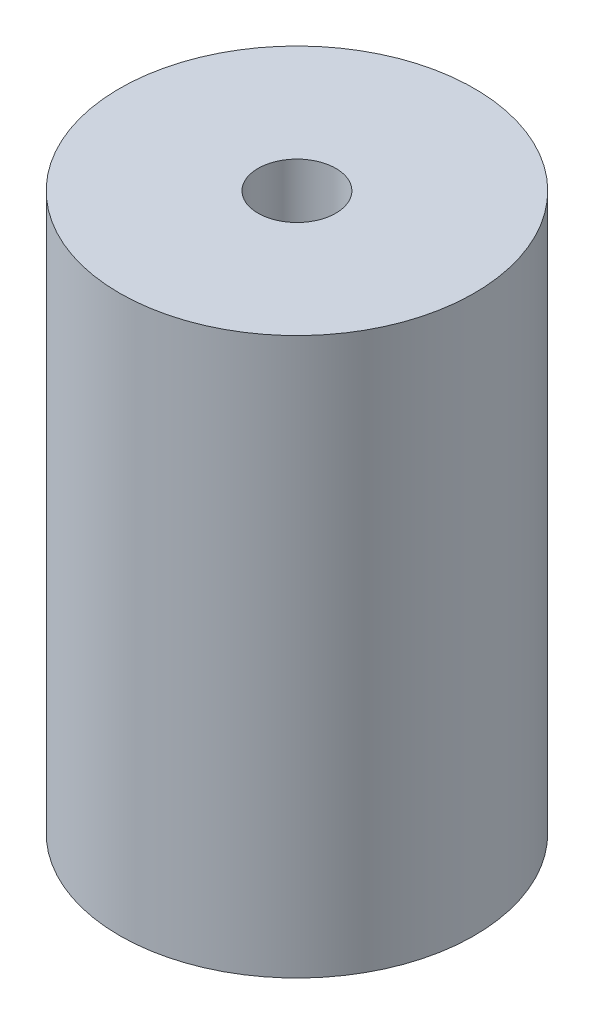
from build123d import *

# Parameters (mm, degrees)
BOSS_EXTRUDE1_DEPTH      = 17
BOSS_EXTRUDE1_DEPTH_BACK = 3
SKETCH1_R                = 6.375
SKETCH1_R_2              = 1.398165138
SKETCH1_3_R              = 6.375
SKETCH1_3_R_2            = 1.398165138
BOSS_EXTRUDE2_DEPTH      = 3


with BuildPart() as part:
    # Sketch1 → Boss-Extrude1 (new, two sides: drawn at the far end of the back side and taken through both)
    with BuildSketch(Plane(origin=(0, 0, 0), x_dir=(1, 0, 0), z_dir=(0, 1, 0)).offset(-BOSS_EXTRUDE1_DEPTH_BACK)):
        Circle(SKETCH1_R)
        Circle(SKETCH1_R_2, mode=Mode.SUBTRACT)
    extrude(amount=BOSS_EXTRUDE1_DEPTH + BOSS_EXTRUDE1_DEPTH_BACK)


with BuildPart() as body_2:
    # Sketch1<3> → Boss-Extrude2 (new body)
    with BuildSketch(Plane(origin=(0, 0, 0), x_dir=(1, 0, 0), z_dir=(0, 1, 0))):
        Circle(SKETCH1_3_R)
        Circle(SKETCH1_3_R_2, mode=Mode.SUBTRACT)
    extrude(amount=-BOSS_EXTRUDE2_DEPTH)


solid = Compound([part.part, body_2.part])
